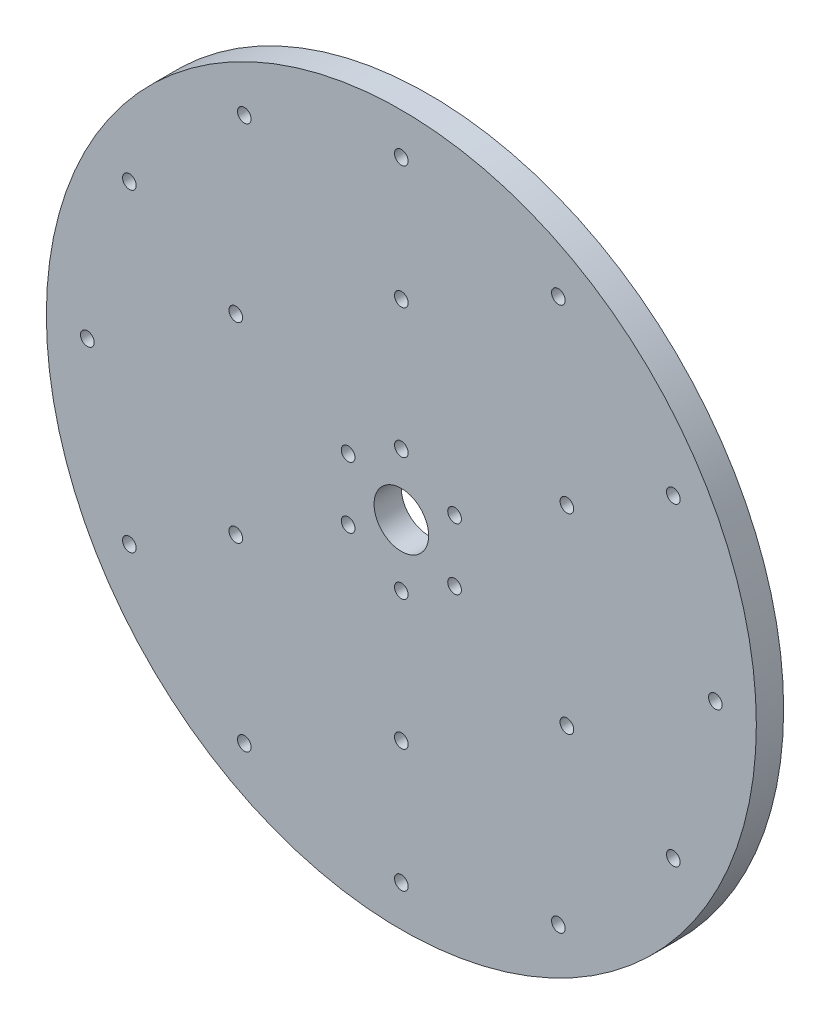
from build123d import *

# Parameters (mm, degrees)
SKETCH_1_R          = 130
EXTRUDE_1_DEPTH     = 10
SKETCH_7_R          = 2.5
CUT_EXTRUDE_3_DEPTH = 10
SKETCH_9_R          = 10
CUT_EXTRUDE_5_DEPTH = 185.119526395
SKETCH_10_R         = 2.5
CUT_EXTRUDE_6_DEPTH = 185.119526395


with BuildPart() as part:
    # 草图1 → 凸台-拉伸1 (new body)
    with BuildSketch(Plane.XY):
        Circle(SKETCH_1_R)
    extrude(amount=EXTRUDE_1_DEPTH)

    # 草图7 → 切除-拉伸3 (cut)
    with BuildSketch(Plane(origin=(0, 0, 0), x_dir=(-1, 0, 0), z_dir=(0, 0, -1))):
        with Locations((0, 70)):
            Circle(SKETCH_7_R)
        with Locations((60.621778265, 35)):
            Circle(SKETCH_7_R)
        with Locations((60.621778265, -35)):
            Circle(SKETCH_7_R)
        with Locations((0, -70)):
            Circle(SKETCH_7_R)
        with Locations((-60.621778265, -35)):
            Circle(SKETCH_7_R)
        with Locations((-60.621778265, 35)):
            Circle(SKETCH_7_R)
        with Locations((57.5, 99.592921435)):
            Circle(SKETCH_7_R)
        with Locations((99.592921435, 57.5)):
            Circle(SKETCH_7_R)
        with Locations((115, 0)):
            Circle(SKETCH_7_R)
        with Locations((99.592921435, -57.5)):
            Circle(SKETCH_7_R)
        with Locations((57.5, -99.592921435)):
            Circle(SKETCH_7_R)
        with Locations((0, -115)):
            Circle(SKETCH_7_R)
        with Locations((-57.5, -99.592921435)):
            Circle(SKETCH_7_R)
        with Locations((-99.592921435, -57.5)):
            Circle(SKETCH_7_R)
        with Locations((-115, 0)):
            Circle(SKETCH_7_R)
        with Locations((-99.592921435, 57.5)):
            Circle(SKETCH_7_R)
        with Locations((-57.5, 99.592921435)):
            Circle(SKETCH_7_R)
        with Locations((0, 115)):
            Circle(SKETCH_7_R)
    extrude(amount=-CUT_EXTRUDE_3_DEPTH, mode=Mode.SUBTRACT)

    # 草图9 → 切除-拉伸5 (cut, through all)
    with BuildSketch(Plane.XY.offset(10)):
        Circle(SKETCH_9_R)
    extrude(amount=-CUT_EXTRUDE_5_DEPTH, mode=Mode.SUBTRACT)

    # 草图10 → 切除-拉伸6 (cut, through all)
    with BuildSketch(Plane.XY.offset(10)):
        with Locations((0, 22.5)):
            Circle(SKETCH_10_R)
        with Locations((19.485571585, 11.25)):
            Circle(SKETCH_10_R)
        with Locations((19.485571585, -11.25)):
            Circle(SKETCH_10_R)
        with Locations((0, -22.5)):
            Circle(SKETCH_10_R)
        with Locations((-19.485571585, -11.25)):
            Circle(SKETCH_10_R)
        with Locations((-19.485571585, 11.25)):
            Circle(SKETCH_10_R)
    extrude(amount=-CUT_EXTRUDE_6_DEPTH, mode=Mode.SUBTRACT)


solid = part.part
